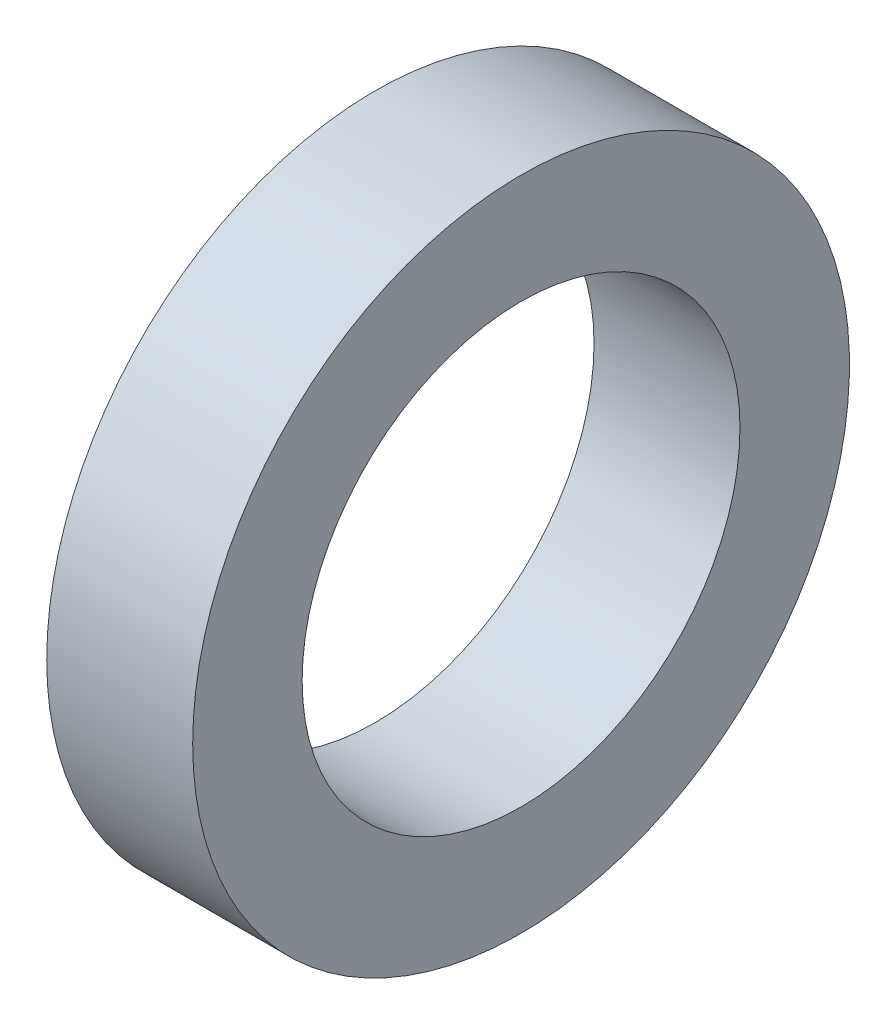
from build123d import *

# Parameters (mm, degrees)
SKETCH2_W = 4
SKETCH2_H = 3


with BuildPart() as part:
    # Sketch2 → Revolve1 (revolve)
    with BuildSketch(Plane.XY, mode=Mode.PRIVATE) as revolve1_sk:
        with Locations((2, 7.5)):
            Rectangle(SKETCH2_W, SKETCH2_H)
    revolve(revolve1_sk.sketch.rotate(Axis((0, 0, 0), (1, 0, 0)), 90), axis=Axis((0, 0, 0), (1, 0, 0)))


solid = part.part
